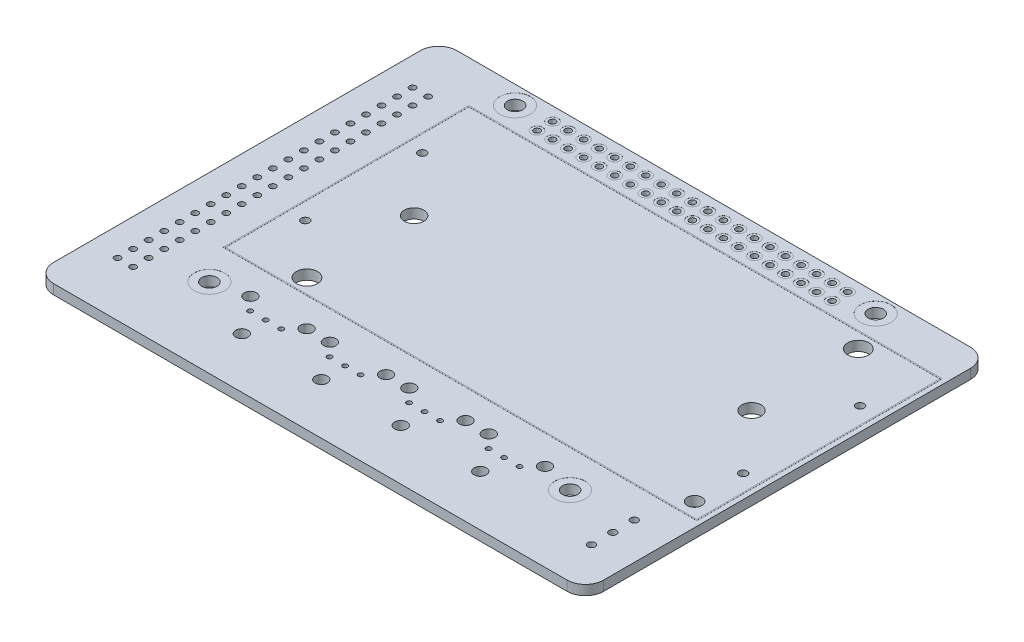
from build123d import *

# Parameters (mm, degrees)
SKETCH1_R            = 1.25
PCB_OUTLINE_DEPTH    = 1.6
SKETCH2_R            = 0.51
F_40_PIN_HOLES_DEPTH = 43.927962915
SKETCH8_R            = 0.91
CUT_EXTRUDE3_DEPTH   = 0.01
SKETCH9_R            = 2.5
CUT_EXTRUDE4_DEPTH   = 0.01
BOSS_EXTRUDE1_START  = -1.6
BOSS_EXTRUDE1_DEPTH  = 1.6
FILLET1_R            = 3
SKETCH11_R           = 1.725
SKETCH11_R_2         = 1.19
SKETCH11_R_3         = 0.66
SKETCH11_R_4         = 1.59
CUT_EXTRUDE5_DEPTH   = 1.6
SKETCH12_W           = 77.46
SKETCH12_H           = 40.18
SKETCH12_W_2         = 77.06
SKETCH12_H_2         = 39.78
BOSS_EXTRUDE2_DEPTH  = 0.01
BOSS_EXTRUDE3_DEPTH  = 1.6
SKETCH14_R           = 1
SKETCH14_R_2         = 0.4
CUT_EXTRUDE6_DEPTH   = 1.6
SKETCH15_R           = 0.6
CUT_EXTRUDE7_DEPTH   = 1.6
SKETCH16_R           = 0.51
CUT_EXTRUDE8_DEPTH   = 1.6


with BuildPart() as part:
    # Sketch1 → PCB-Outline (new body)
    with BuildSketch(Plane(origin=(0, 0, 0), x_dir=(1, 0, 0), z_dir=(0, 1, 0))):
        with BuildLine():
            Line((-29.5, -28), (29.5, -28))
            ThreePointArc((29.5, -28), (31.621320344, -27.121320344), (32.5, -25))
            Line((32.5, -25), (32.5, 25))
            ThreePointArc((32.5, 25), (31.621320344, 27.121320344), (29.5, 28))
            Line((29.5, 28), (-29.5, 28))
            ThreePointArc((-29.5, 28), (-31.621320344, 27.121320344), (-32.5, 25))
            Line((-32.5, 25), (-32.5, -25))
            ThreePointArc((-32.5, -25), (-31.621320344, -27.121320344), (-29.5, -28))
        make_face()
        with Locations(Location((-29.5, 25, 0), (0, 0, 270))):
            Circle(SKETCH1_R, mode=Mode.SUBTRACT)
        with Locations(Location((29.5, 25, 0), (0, 0, 90))):
            Circle(SKETCH1_R, mode=Mode.SUBTRACT)
        with Locations(Location((29.5, -25, 0), (0, 0, 270))):
            Circle(SKETCH1_R, mode=Mode.SUBTRACT)
        with Locations(Location((-29.5, -25, 0), (0, 0, 90))):
            Circle(SKETCH1_R, mode=Mode.SUBTRACT)
    extrude(amount=PCB_OUTLINE_DEPTH)

    # Sketch2 → 40-Pin-Holes (cut, through all)
    with BuildSketch(Plane(origin=(0, 1.6, 0), x_dir=(1, 0, 0), z_dir=(0, 1, 0))):
        with Locations(Location((-24.13, 25.77, 0), (0, 0, 270))):
            Circle(SKETCH2_R)
        with Locations(Location((-24.13, 23.23, 0), (0, 0, 270))):
            Circle(SKETCH2_R)
        with Locations(Location((-21.59, 25.77, 0), (0, 0, 270))):
            Circle(SKETCH2_R)
        with Locations(Location((-21.59, 23.23, 0), (0, 0, 270))):
            Circle(SKETCH2_R)
        with Locations(Location((-19.05, 25.77, 0), (0, 0, 270))):
            Circle(SKETCH2_R)
        with Locations(Location((-19.05, 23.23, 0), (0, 0, 270))):
            Circle(SKETCH2_R)
        with Locations(Location((-16.51, 25.77, 0), (0, 0, 270))):
            Circle(SKETCH2_R)
        with Locations(Location((-16.51, 23.23, 0), (0, 0, 270))):
            Circle(SKETCH2_R)
        with Locations(Location((-13.97, 25.77, 0), (0, 0, 270))):
            Circle(SKETCH2_R)
        with Locations(Location((-13.97, 23.23, 0), (0, 0, 270))):
            Circle(SKETCH2_R)
        with Locations(Location((-11.43, 25.77, 0), (0, 0, 270))):
            Circle(SKETCH2_R)
        with Locations(Location((-11.43, 23.23, 0), (0, 0, 270))):
            Circle(SKETCH2_R)
        with Locations(Location((-8.89, 25.77, 0), (0, 0, 270))):
            Circle(SKETCH2_R)
        with Locations(Location((-8.89, 23.23, 0), (0, 0, 270))):
            Circle(SKETCH2_R)
        with Locations(Location((-6.35, 25.77, 0), (0, 0, 270))):
            Circle(SKETCH2_R)
        with Locations(Location((-6.35, 23.23, 0), (0, 0, 270))):
            Circle(SKETCH2_R)
        with Locations(Location((-3.81, 25.77, 0), (0, 0, 270))):
            Circle(SKETCH2_R)
        with Locations(Location((-3.81, 23.23, 0), (0, 0, 270))):
            Circle(SKETCH2_R)
        with Locations(Location((-1.27, 25.77, 0), (0, 0, 270))):
            Circle(SKETCH2_R)
        with Locations(Location((-1.27, 23.23, 0), (0, 0, 270))):
            Circle(SKETCH2_R)
        with Locations(Location((1.27, 25.77, 0), (0, 0, 270))):
            Circle(SKETCH2_R)
        with Locations(Location((1.27, 23.23, 0), (0, 0, 270))):
            Circle(SKETCH2_R)
        with Locations(Location((3.81, 25.77, 0), (0, 0, 270))):
            Circle(SKETCH2_R)
        with Locations(Location((3.81, 23.23, 0), (0, 0, 270))):
            Circle(SKETCH2_R)
        with Locations(Location((6.35, 25.77, 0), (0, 0, 270))):
            Circle(SKETCH2_R)
        with Locations(Location((6.35, 23.23, 0), (0, 0, 270))):
            Circle(SKETCH2_R)
        with Locations(Location((8.89, 25.77, 0), (0, 0, 270))):
            Circle(SKETCH2_R)
        with Locations(Location((8.89, 23.23, 0), (0, 0, 270))):
            Circle(SKETCH2_R)
        with Locations(Location((11.43, 25.77, 0), (0, 0, 270))):
            Circle(SKETCH2_R)
        with Locations(Location((11.43, 23.23, 0), (0, 0, 270))):
            Circle(SKETCH2_R)
        with Locations(Location((13.97, 25.77, 0), (0, 0, 270))):
            Circle(SKETCH2_R)
        with Locations(Location((13.97, 23.23, 0), (0, 0, 270))):
            Circle(SKETCH2_R)
        with Locations(Location((16.51, 25.77, 0), (0, 0, 270))):
            Circle(SKETCH2_R)
        with Locations(Location((16.51, 23.23, 0), (0, 0, 270))):
            Circle(SKETCH2_R)
        with Locations(Location((19.05, 25.77, 0), (0, 0, 270))):
            Circle(SKETCH2_R)
        with Locations(Location((19.05, 23.23, 0), (0, 0, 270))):
            Circle(SKETCH2_R)
        with Locations(Location((21.59, 25.77, 0), (0, 0, 270))):
            Circle(SKETCH2_R)
        with Locations(Location((21.59, 23.23, 0), (0, 0, 270))):
            Circle(SKETCH2_R)
        with Locations(Location((24.13, 25.77, 0), (0, 0, 270))):
            Circle(SKETCH2_R)
        with Locations(Location((24.13, 23.23, 0), (0, 0, 270))):
            Circle(SKETCH2_R)
    extrude(amount=-F_40_PIN_HOLES_DEPTH, mode=Mode.SUBTRACT)

    # Sketch8 → Cut-Extrude3 (cut)
    with BuildSketch(Plane(origin=(0, 1.6, 0), x_dir=(1, 0, 0), z_dir=(0, 1, 0))):
        with Locations(Location((-24.13, 25.77, 0), (0, 0, 270))):
            Circle(SKETCH8_R)
        with Locations(Location((-21.59, 25.77, 0), (0, 0, 270))):
            Circle(SKETCH8_R)
        with Locations(Location((-19.05, 25.77, 0), (0, 0, 270))):
            Circle(SKETCH8_R)
        with Locations(Location((-16.51, 25.77, 0), (0, 0, 270))):
            Circle(SKETCH8_R)
        with Locations(Location((-13.97, 25.77, 0), (0, 0, 270))):
            Circle(SKETCH8_R)
        with Locations(Location((-11.43, 25.77, 0), (0, 0, 270))):
            Circle(SKETCH8_R)
        with Locations(Location((-8.89, 25.77, 0), (0, 0, 270))):
            Circle(SKETCH8_R)
        with Locations(Location((-6.35, 25.77, 0), (0, 0, 270))):
            Circle(SKETCH8_R)
        with Locations(Location((-3.81, 25.77, 0), (0, 0, 270))):
            Circle(SKETCH8_R)
        with Locations(Location((-1.27, 25.77, 0), (0, 0, 270))):
            Circle(SKETCH8_R)
        with Locations(Location((1.27, 25.77, 0), (0, 0, 270))):
            Circle(SKETCH8_R)
        with Locations(Location((3.81, 25.77, 0), (0, 0, 270))):
            Circle(SKETCH8_R)
        with Locations(Location((6.35, 25.77, 0), (0, 0, 270))):
            Circle(SKETCH8_R)
        with Locations(Location((8.89, 25.77, 0), (0, 0, 270))):
            Circle(SKETCH8_R)
        with Locations(Location((11.43, 25.77, 0), (0, 0, 270))):
            Circle(SKETCH8_R)
        with Locations(Location((13.97, 25.77, 0), (0, 0, 270))):
            Circle(SKETCH8_R)
        with Locations(Location((16.51, 25.77, 0), (0, 0, 270))):
            Circle(SKETCH8_R)
        with Locations(Location((19.05, 25.77, 0), (0, 0, 270))):
            Circle(SKETCH8_R)
        with Locations(Location((21.59, 25.77, 0), (0, 0, 270))):
            Circle(SKETCH8_R)
        with Locations(Location((24.13, 25.77, 0), (0, 0, 270))):
            Circle(SKETCH8_R)
        with Locations(Location((-21.59, 23.23, 0), (0, 0, 270))):
            Circle(SKETCH8_R)
        with Locations(Location((-19.05, 23.23, 0), (0, 0, 270))):
            Circle(SKETCH8_R)
        with Locations(Location((-16.51, 23.23, 0), (0, 0, 270))):
            Circle(SKETCH8_R)
        with Locations(Location((-13.97, 23.23, 0), (0, 0, 270))):
            Circle(SKETCH8_R)
        with Locations(Location((-11.43, 23.23, 0), (0, 0, 270))):
            Circle(SKETCH8_R)
        with Locations(Location((-8.89, 23.23, 0), (0, 0, 270))):
            Circle(SKETCH8_R)
        with Locations(Location((-6.35, 23.23, 0), (0, 0, 270))):
            Circle(SKETCH8_R)
        with Locations(Location((-3.81, 23.23, 0), (0, 0, 270))):
            Circle(SKETCH8_R)
        with Locations(Location((-1.27, 23.23, 0), (0, 0, 270))):
            Circle(SKETCH8_R)
        with Locations(Location((1.27, 23.23, 0), (0, 0, 270))):
            Circle(SKETCH8_R)
        with Locations(Location((3.81, 23.23, 0), (0, 0, 270))):
            Circle(SKETCH8_R)
        with Locations(Location((6.35, 23.23, 0), (0, 0, 270))):
            Circle(SKETCH8_R)
        with Locations(Location((8.89, 23.23, 0), (0, 0, 270))):
            Circle(SKETCH8_R)
        with Locations(Location((11.43, 23.23, 0), (0, 0, 270))):
            Circle(SKETCH8_R)
        with Locations(Location((13.97, 23.23, 0), (0, 0, 270))):
            Circle(SKETCH8_R)
        with Locations(Location((16.51, 23.23, 0), (0, 0, 270))):
            Circle(SKETCH8_R)
        with Locations(Location((19.05, 23.23, 0), (0, 0, 270))):
            Circle(SKETCH8_R)
        with Locations(Location((21.59, 23.23, 0), (0, 0, 270))):
            Circle(SKETCH8_R)
        with Locations(Location((24.13, 23.23, 0), (0, 0, 270))):
            Circle(SKETCH8_R)
        with Locations(Location((-24.13, 23.23, 0), (0, 0, 270))):
            Circle(SKETCH8_R)
    cut_extrude3 = extrude(amount=-CUT_EXTRUDE3_DEPTH, mode=Mode.SUBTRACT)

    # Mirror1: Cut-Extrude3 across plane
    add(cut_extrude3.mirror(Plane(origin=(0, 0.8, 0), x_dir=(0, 0, 1), z_dir=(0, -1, 0))), mode=Mode.SUBTRACT)

    # Sketch9 → Cut-Extrude4 (cut)
    with BuildSketch(Plane(origin=(0, 1.6, 0), x_dir=(1, 0, 0), z_dir=(0, 1, 0))):
        with Locations(Location((-29.5, 25, 0), (0, 0, 270))):
            Circle(SKETCH9_R)
        with Locations(Location((29.5, 25, 0), (0, 0, 270))):
            Circle(SKETCH9_R)
        with Locations(Location((29.5, -25, 0), (0, 0, 270))):
            Circle(SKETCH9_R)
        with Locations(Location((-29.5, -25, 0), (0, 0, 270))):
            Circle(SKETCH9_R)
    cut_extrude4 = extrude(amount=-CUT_EXTRUDE4_DEPTH, mode=Mode.SUBTRACT)

    # Mirror2: Cut-Extrude4 across plane
    add(cut_extrude4.mirror(Plane(origin=(0, 0.8, 0), x_dir=(0, 0, 1), z_dir=(0, -1, 0))), mode=Mode.SUBTRACT)

    # Sketch10 → Boss-Extrude1 (add)
    with BuildSketch(Plane(origin=(0, 1.6, 0), x_dir=(1, 0, 0), z_dir=(0, 1, 0)).offset(BOSS_EXTRUDE1_START)):
        with BuildLine():
            Line((-29.5, 28), (-45, 28))
            Line((-45, 28), (-45, -28))
            Line((-45, -28), (-29.5, -28))
            ThreePointArc((-29.5, -28), (-31.621320344, -27.121320344), (-32.5, -25))
            Line((-32.5, -25), (-32.5, 25))
            ThreePointArc((-32.5, 25), (-31.621320344, 27.121320344), (-29.5, 28))
        make_face()
        with BuildLine():
            Line((32.5, 25), (32.5, -25))
            ThreePointArc((32.5, -25), (31.621320344, -27.121320344), (29.5, -28))
            Line((29.5, -28), (45, -28))
            Line((45, -28), (45, 28))
            Line((45, 28), (29.5, 28))
            ThreePointArc((29.5, 28), (31.621320344, 27.121320344), (32.5, 25))
        make_face()
    extrude(amount=BOSS_EXTRUDE1_DEPTH)

    # Fillet1
    fillet1_edges = [part.edges().sort_by_distance(p)[0] for p in [
        (-45, 0.8, 28),
        (-45, 0.8, -28),
        (45, 0.8, -28),
        (45, 0.8, 28),
    ]]
    fillet(fillet1_edges, radius=FILLET1_R)

    # Sketch11 → Cut-Extrude5 (cut)
    with BuildSketch(Plane(origin=(0, 1.6, 0), x_dir=(1, 0, 0), z_dir=(0, 1, 0))):
        with Locations(Location((-22.13, -16.42, 0), (0, 0, 270))):
            Circle(SKETCH11_R)
        with Locations(Location((33.07, 18.58, 0), (0, 0, 270))):
            Circle(SKETCH11_R)
        with Locations(Location((41.29, -16.42, 0), (0, 0, 270))):
            Circle(SKETCH11_R_2)
        with Locations(Location((41.29, -8.47, 0), (0, 0, 270))):
            Circle(SKETCH11_R_3)
        with Locations(Location((-30.35, -8.47, 0), (0, 0, 270))):
            Circle(SKETCH11_R_3)
        with Locations(Location((-30.35, 10.66, 0), (0, 0, 270))):
            Circle(SKETCH11_R_3)
        with Locations(Location((41.29, 10.66, 0), (0, 0, 270))):
            Circle(SKETCH11_R_3)
        with Locations(Location((-22.13, 1.11, 0), (0, 0, 270))):
            Circle(SKETCH11_R_4)
        with Locations(Location((33.07, 1.11, 0), (0, 0, 270))):
            Circle(SKETCH11_R_4)
    extrude(amount=-CUT_EXTRUDE5_DEPTH, mode=Mode.SUBTRACT)

    # Sketch12 → Boss-Extrude2 (add)
    with BuildSketch(Plane(origin=(0, 1.6, 0), x_dir=(1, 0, 0), z_dir=(0, 1, 0))):
        with Locations((5.47, 1.11)):
            Rectangle(SKETCH12_W, SKETCH12_H)
        with Locations((5.47, 1.11)):
            Rectangle(SKETCH12_W_2, SKETCH12_H_2, mode=Mode.SUBTRACT)
    extrude(amount=BOSS_EXTRUDE2_DEPTH)

    # Sketch13 → Boss-Extrude3 (add)
    with BuildSketch(Plane(origin=(0, 1.6, 0), x_dir=(1, 0, 0), z_dir=(0, 1, 0))):
        with BuildLine():
            Line((-45, -25), (-45, -35))
            ThreePointArc((-45, -35), (-44.121320344, -37.121320344), (-42, -38))
            Line((-42, -38), (42, -38))
            ThreePointArc((42, -38), (44.121320344, -37.121320344), (45, -35))
            Line((45, -35), (45, -25))
            ThreePointArc((45, -25), (44.121320344, -27.121320344), (42, -28))
            Line((42, -28), (-42, -28))
            ThreePointArc((-42, -28), (-44.121320344, -27.121320344), (-45, -25))
        make_face()
    extrude(amount=-BOSS_EXTRUDE3_DEPTH)

    # Sketch14 → Cut-Extrude6 (cut)
    with BuildSketch(Plane(origin=(0, 1.6, 0), x_dir=(1, 0, 0), z_dir=(0, 1, 0))):
        with Locations(Location((-24.1, -23.7, 0), (0, 0, 270))):
            Circle(SKETCH14_R)
        with Locations(Location((-14.9, -23.7, 0), (0, 0, 270))):
            Circle(SKETCH14_R)
        with Locations(Location((-19.5, -29.7, 0), (0, 0, 270))):
            Circle(SKETCH14_R)
        with Locations(Location((-22.04, -25.8, 0), (0, 0, 270))):
            Circle(SKETCH14_R_2)
        with Locations(Location((-19.5, -25.8, 0), (0, 0, 270))):
            Circle(SKETCH14_R_2)
        with Locations(Location((-16.96, -25.8, 0), (0, 0, 270))):
            Circle(SKETCH14_R_2)
        with Locations(Location((-11.1, -23.7, 0), (0, 0, 270))):
            Circle(SKETCH14_R)
        with Locations(Location((-1.9, -23.7, 0), (0, 0, 270))):
            Circle(SKETCH14_R)
        with Locations(Location((-6.5, -29.7, 0), (0, 0, 270))):
            Circle(SKETCH14_R)
        with Locations(Location((-9.04, -25.8, 0), (0, 0, 270))):
            Circle(SKETCH14_R_2)
        with Locations(Location((-6.5, -25.8, 0), (0, 0, 270))):
            Circle(SKETCH14_R_2)
        with Locations(Location((-3.96, -25.8, 0), (0, 0, 270))):
            Circle(SKETCH14_R_2)
        with Locations(Location((1.9, -23.7, 0), (0, 0, 270))):
            Circle(SKETCH14_R)
        with Locations(Location((11.1, -23.7, 0), (0, 0, 270))):
            Circle(SKETCH14_R)
        with Locations(Location((6.5, -29.7, 0), (0, 0, 270))):
            Circle(SKETCH14_R)
        with Locations(Location((3.96, -25.8, 0), (0, 0, 270))):
            Circle(SKETCH14_R_2)
        with Locations(Location((6.5, -25.8, 0), (0, 0, 270))):
            Circle(SKETCH14_R_2)
        with Locations(Location((9.04, -25.8, 0), (0, 0, 270))):
            Circle(SKETCH14_R_2)
        with Locations(Location((14.9, -23.7, 0), (0, 0, 270))):
            Circle(SKETCH14_R)
        with Locations(Location((24.1, -23.7, 0), (0, 0, 270))):
            Circle(SKETCH14_R)
        with Locations(Location((19.5, -29.7, 0), (0, 0, 270))):
            Circle(SKETCH14_R)
        with Locations(Location((16.96, -25.8, 0), (0, 0, 270))):
            Circle(SKETCH14_R_2)
        with Locations(Location((19.5, -25.8, 0), (0, 0, 270))):
            Circle(SKETCH14_R_2)
        with Locations(Location((22.04, -25.8, 0), (0, 0, 270))):
            Circle(SKETCH14_R_2)
    extrude(amount=-CUT_EXTRUDE6_DEPTH, mode=Mode.SUBTRACT)

    # Sketch15 → Cut-Extrude7 (cut)
    with BuildSketch(Plane.XZ):
        with Locations(Location((39, 31, 0), (0, 0, 270))):
            Circle(SKETCH15_R)
        with Locations(Location((39, 24, 0), (0, 0, 270))):
            Circle(SKETCH15_R)
        with Locations(Location((39, 27.5, 0), (0, 0, 270))):
            Circle(SKETCH15_R)
    extrude(amount=-CUT_EXTRUDE7_DEPTH, mode=Mode.SUBTRACT)

    # Sketch16 → Cut-Extrude8 (cut)
    with BuildSketch(Plane(origin=(0, 1.6, 0), x_dir=(1, 0, 0), z_dir=(0, 1, 0))):
        with Locations(Location((-37.86, 19.13, 0), (0, 0, 270))):
            Circle(SKETCH16_R)
        with Locations(Location((-40.4, 19.13, 0), (0, 0, 270))):
            Circle(SKETCH16_R)
        with Locations(Location((-40.4, 16.59, 0), (0, 0, 270))):
            Circle(SKETCH16_R)
        with Locations(Location((-37.86, 16.59, 0), (0, 0, 270))):
            Circle(SKETCH16_R)
        with Locations(Location((-40.4, 14.05, 0), (0, 0, 270))):
            Circle(SKETCH16_R)
        with Locations(Location((-37.86, 14.05, 0), (0, 0, 270))):
            Circle(SKETCH16_R)
        with Locations(Location((-40.4, 11.51, 0), (0, 0, 270))):
            Circle(SKETCH16_R)
        with Locations(Location((-37.86, 11.51, 0), (0, 0, 270))):
            Circle(SKETCH16_R)
        with Locations(Location((-40.4, 8.97, 0), (0, 0, 270))):
            Circle(SKETCH16_R)
        with Locations(Location((-37.86, 8.97, 0), (0, 0, 270))):
            Circle(SKETCH16_R)
        with Locations(Location((-40.4, 6.43, 0), (0, 0, 270))):
            Circle(SKETCH16_R)
        with Locations(Location((-37.86, 6.43, 0), (0, 0, 270))):
            Circle(SKETCH16_R)
        with Locations(Location((-40.4, 3.89, 0), (0, 0, 270))):
            Circle(SKETCH16_R)
        with Locations(Location((-37.86, 3.89, 0), (0, 0, 270))):
            Circle(SKETCH16_R)
        with Locations(Location((-40.4, 1.35, 0), (0, 0, 270))):
            Circle(SKETCH16_R)
        with Locations(Location((-37.86, 1.35, 0), (0, 0, 270))):
            Circle(SKETCH16_R)
        with Locations(Location((-40.4, -1.19, 0), (0, 0, 270))):
            Circle(SKETCH16_R)
        with Locations(Location((-37.86, -1.19, 0), (0, 0, 270))):
            Circle(SKETCH16_R)
        with Locations(Location((-40.4, -3.73, 0), (0, 0, 270))):
            Circle(SKETCH16_R)
        with Locations(Location((-37.86, -3.73, 0), (0, 0, 270))):
            Circle(SKETCH16_R)
        with Locations(Location((-40.4, -6.27, 0), (0, 0, 270))):
            Circle(SKETCH16_R)
        with Locations(Location((-37.86, -6.27, 0), (0, 0, 270))):
            Circle(SKETCH16_R)
        with Locations(Location((-40.4, -8.81, 0), (0, 0, 270))):
            Circle(SKETCH16_R)
        with Locations(Location((-37.86, -8.81, 0), (0, 0, 270))):
            Circle(SKETCH16_R)
        with Locations(Location((-40.4, -11.35, 0), (0, 0, 270))):
            Circle(SKETCH16_R)
        with Locations(Location((-37.86, -11.35, 0), (0, 0, 270))):
            Circle(SKETCH16_R)
        with Locations(Location((-40.4, -13.89, 0), (0, 0, 270))):
            Circle(SKETCH16_R)
        with Locations(Location((-37.86, -13.89, 0), (0, 0, 270))):
            Circle(SKETCH16_R)
        with Locations(Location((-40.4, -16.43, 0), (0, 0, 270))):
            Circle(SKETCH16_R)
        with Locations(Location((-37.86, -16.43, 0), (0, 0, 270))):
            Circle(SKETCH16_R)
        with Locations(Location((-40.4, -18.97, 0), (0, 0, 270))):
            Circle(SKETCH16_R)
        with Locations(Location((-37.86, -18.97, 0), (0, 0, 270))):
            Circle(SKETCH16_R)
        with Locations(Location((-40.4, -21.51, 0), (0, 0, 270))):
            Circle(SKETCH16_R)
        with Locations(Location((-37.86, -21.51, 0), (0, 0, 270))):
            Circle(SKETCH16_R)
        with Locations(Location((-40.4, -24.05, 0), (0, 0, 270))):
            Circle(SKETCH16_R)
        with Locations(Location((-37.86, -24.05, 0), (0, 0, 270))):
            Circle(SKETCH16_R)
        with Locations(Location((-40.4, -26.59, 0), (0, 0, 270))):
            Circle(SKETCH16_R)
        with Locations(Location((-37.86, -26.59, 0), (0, 0, 270))):
            Circle(SKETCH16_R)
        with Locations(Location((-40.4, -29.13, 0), (0, 0, 270))):
            Circle(SKETCH16_R)
        with Locations(Location((-37.86, -29.13, 0), (0, 0, 270))):
            Circle(SKETCH16_R)
    extrude(amount=-CUT_EXTRUDE8_DEPTH, mode=Mode.SUBTRACT)


solid = part.part
